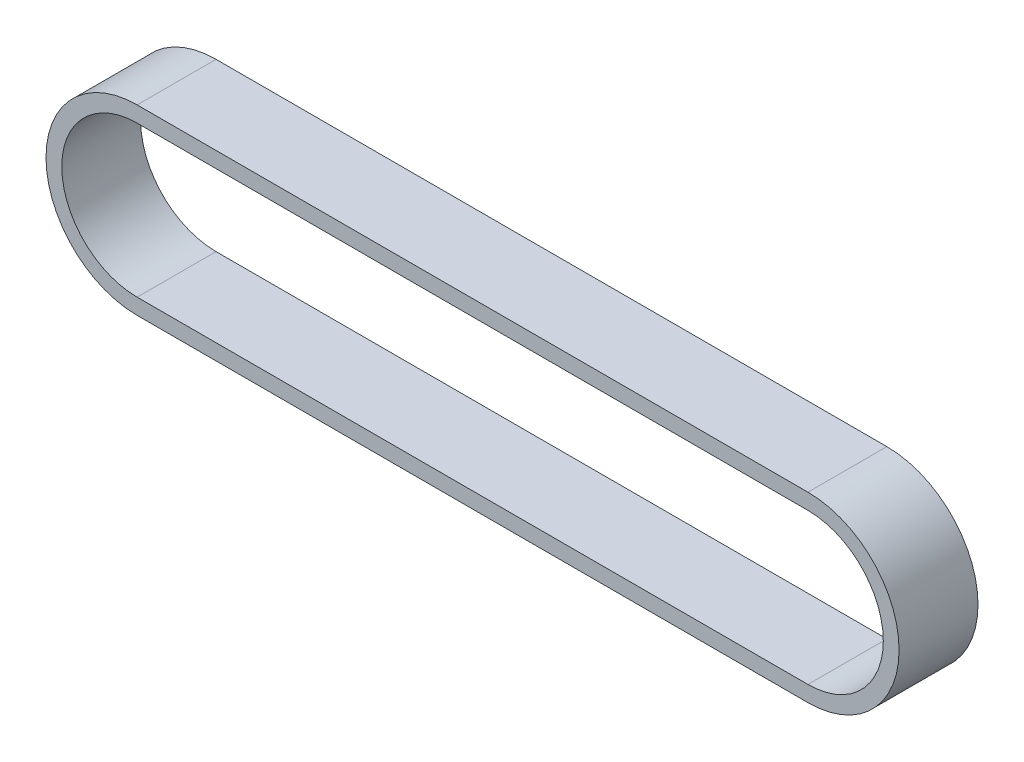
from build123d import *

# Parameters (mm, degrees)
EXTRUDE_THIN1_DEPTH = 7.5


with BuildPart() as part:
    # Sketch2 → Extrude-Thin1 (new, symmetric)
    with BuildSketch(Plane.XY):
        with BuildLine():
            Line((127.496685237, -17.325), (0, -17.325))
            ThreePointArc((0, -17.325), (-17.325, 0), (0, 17.325))
            Line((0, 17.325), (127.496685237, 17.325))
            ThreePointArc((127.496685237, 17.325), (144.821685237, 0), (127.496685237, -17.325))
        make_face()
        with BuildLine():
            Line((127.496685237, -14.325), (0, -14.325))
            ThreePointArc((0, -14.325), (-14.325, 0), (0, 14.325))
            Line((0, 14.325), (127.496685237, 14.325))
            ThreePointArc((127.496685237, 14.325), (141.821685237, 0), (127.496685237, -14.325))
        make_face(mode=Mode.SUBTRACT)
    extrude(amount=EXTRUDE_THIN1_DEPTH, both=True)


solid = part.part
